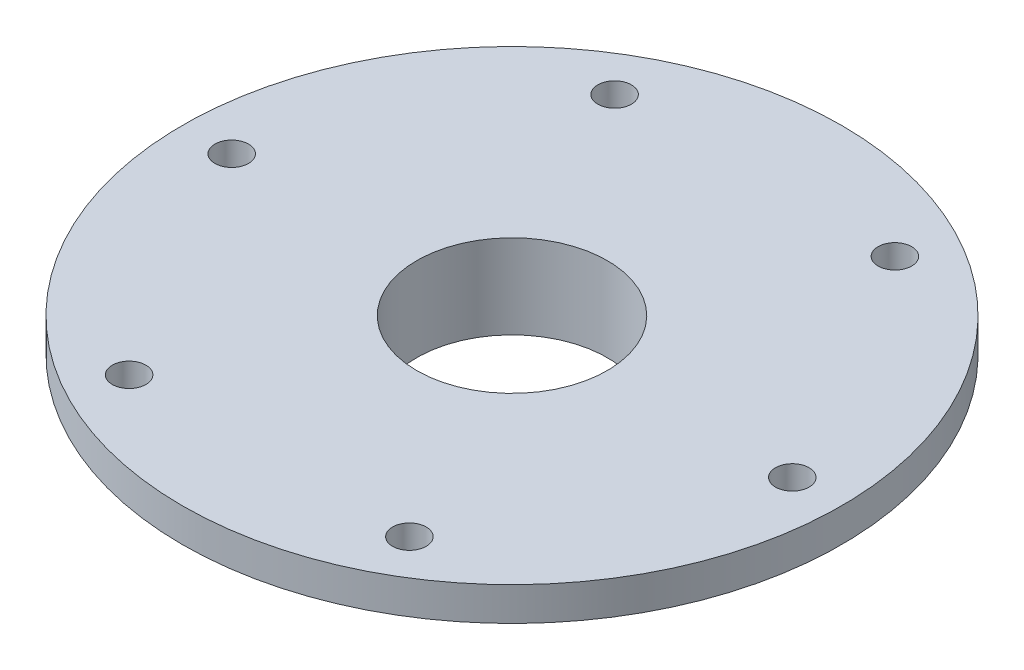
from build123d import *

# Parameters (mm, degrees)
SKETCH5_R          = 1.5
CUT_EXTRUDE1_DEPTH = 43.24020689


with BuildPart() as part:
    # Sketch4 → Revolve1 (revolve)
    with BuildSketch(Plane.XY, mode=Mode.PRIVATE) as revolve1_sk:
        Polygon((-8.5, 0), (-29.39375, 0), (-29.39375, -3), (-11.75, -3), (-11.75, -7.5), (-8.5, -7.5), align=None)
    revolve(revolve1_sk.sketch.rotate(Axis((0, 27.279243053, 0), (0, -1, 0)), 270), axis=Axis((0, 27.279243053, 0), (0, -1, 0)))

    # Sketch5 → Cut-Extrude1 (cut, through all)
    with BuildSketch(Plane(origin=(0, 0, 0), x_dir=(1, 0, 0), z_dir=(0, 1, 0))):
        with Locations(Location((-25, 0, 0), (0, 0, 270))):
            Circle(SKETCH5_R)
        with Locations(Location((-12.5, 21.650635095, 0), (0, 0, 270))):
            Circle(SKETCH5_R)
        with Locations(Location((12.5, 21.650635095, 0), (0, 0, 270))):
            Circle(SKETCH5_R)
        with Locations(Location((25, 0, 0), (0, 0, 270))):
            Circle(SKETCH5_R)
        with Locations(Location((12.5, -21.650635095, 0), (0, 0, 270))):
            Circle(SKETCH5_R)
        with Locations(Location((-12.5, -21.650635095, 0), (0, 0, 270))):
            Circle(SKETCH5_R)
    extrude(amount=-CUT_EXTRUDE1_DEPTH, mode=Mode.SUBTRACT)


solid = part.part
